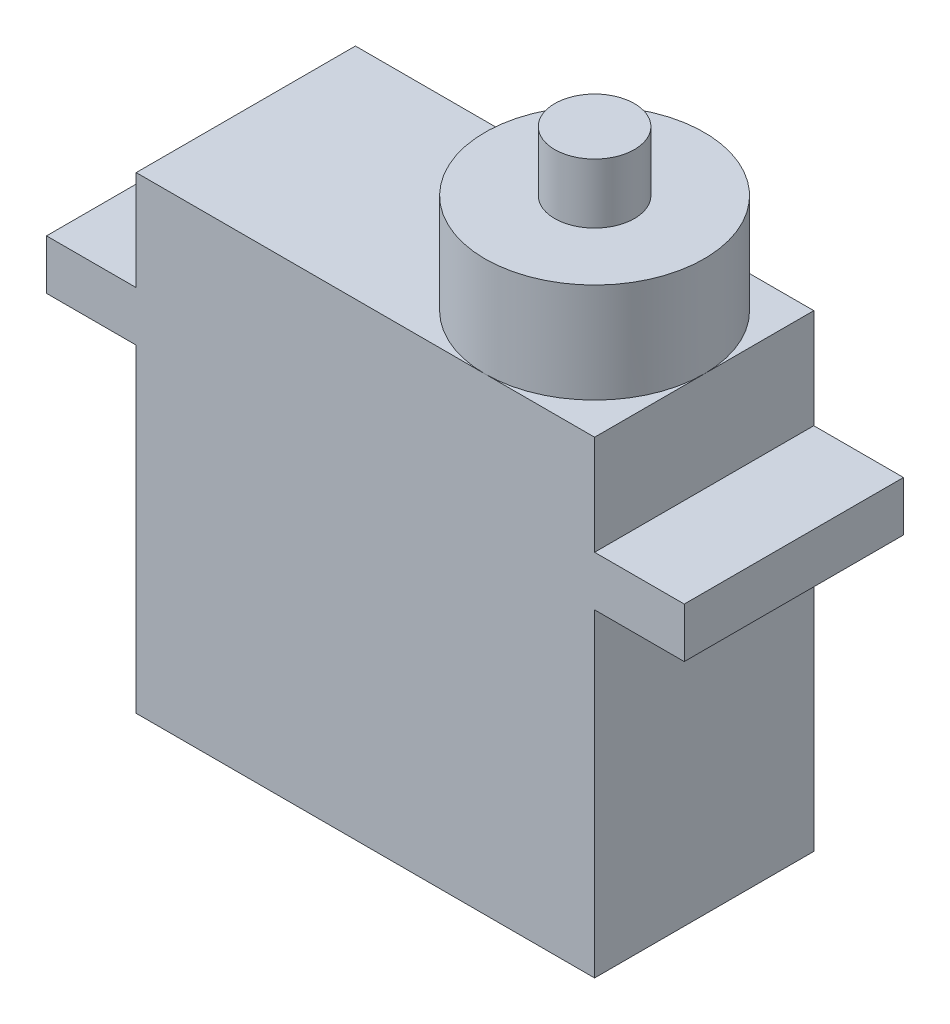
from build123d import *

# Parameters (mm, degrees)
SKETCH1_W           = 23
SKETCH1_H           = 11
BOSS_EXTRUDE1_DEPTH = 16
SKETCH2_W           = 32
SKETCH2_H           = 11
BOSS_EXTRUDE2_DEPTH = 2.5
SKETCH3_W           = 23
SKETCH3_H           = 11
BOSS_EXTRUDE3_DEPTH = 5
BOSS_EXTRUDE4_DEPTH = 5
BOSS_EXTRUDE5_DEPTH = 3


with BuildPart() as part:
    # Sketch1 → Boss-Extrude1 (new body)
    with BuildSketch(Plane(origin=(0, 0, 0), x_dir=(1, 0, 0), z_dir=(0, 1, 0))):
        Rectangle(SKETCH1_W, SKETCH1_H)
    extrude(amount=BOSS_EXTRUDE1_DEPTH)

    # Sketch2 → Boss-Extrude2 (add)
    with BuildSketch(Plane(origin=(0, 16, 0), x_dir=(1, 0, 0), z_dir=(0, 1, 0))):
        Rectangle(SKETCH2_W, SKETCH2_H)
    extrude(amount=BOSS_EXTRUDE2_DEPTH)

    # Sketch3 → Boss-Extrude3 (add)
    with BuildSketch(Plane(origin=(0, 18.5, 0), x_dir=(1, 0, 0), z_dir=(0, 1, 0))):
        Rectangle(SKETCH3_W, SKETCH3_H)
    extrude(amount=BOSS_EXTRUDE3_DEPTH)

    # Sketch4 → Boss-Extrude4 (add)
    with BuildSketch(Plane(origin=(0, 23.5, 0), x_dir=(1, 0, 0), z_dir=(0, 1, 0))):
        with BuildLine():
            ThreePointArc((11.5, 0), (2.110912703, 3.889087297), (6, -5.5))
            Line((6, -5.5), (6, 0))
            Line((6, 0), (11.5, 0))
        make_face()
        with BuildLine():
            Line((6, 0), (6, -5.5))
            ThreePointArc((6, -5.5), (9.889087297, -3.889087297), (11.5, 0))
            Line((11.5, 0), (6, 0))
        make_face()
    extrude(amount=BOSS_EXTRUDE4_DEPTH)

    # Sketch5 → Boss-Extrude5 (add)
    with BuildSketch(Plane(origin=(0, 28.5, 0), x_dir=(1, 0, 0), z_dir=(0, 1, 0))):
        with BuildLine():
            ThreePointArc((8, 0), (4.585786438, 1.414213562), (6, -2))
            Line((6, -2), (6, 0))
            Line((6, 0), (8, 0))
        make_face()
        with BuildLine():
            Line((6, 0), (6, -2))
            ThreePointArc((6, -2), (7.414213562, -1.414213562), (8, 0))
            Line((8, 0), (6, 0))
        make_face()
    extrude(amount=BOSS_EXTRUDE5_DEPTH)


solid = part.part
